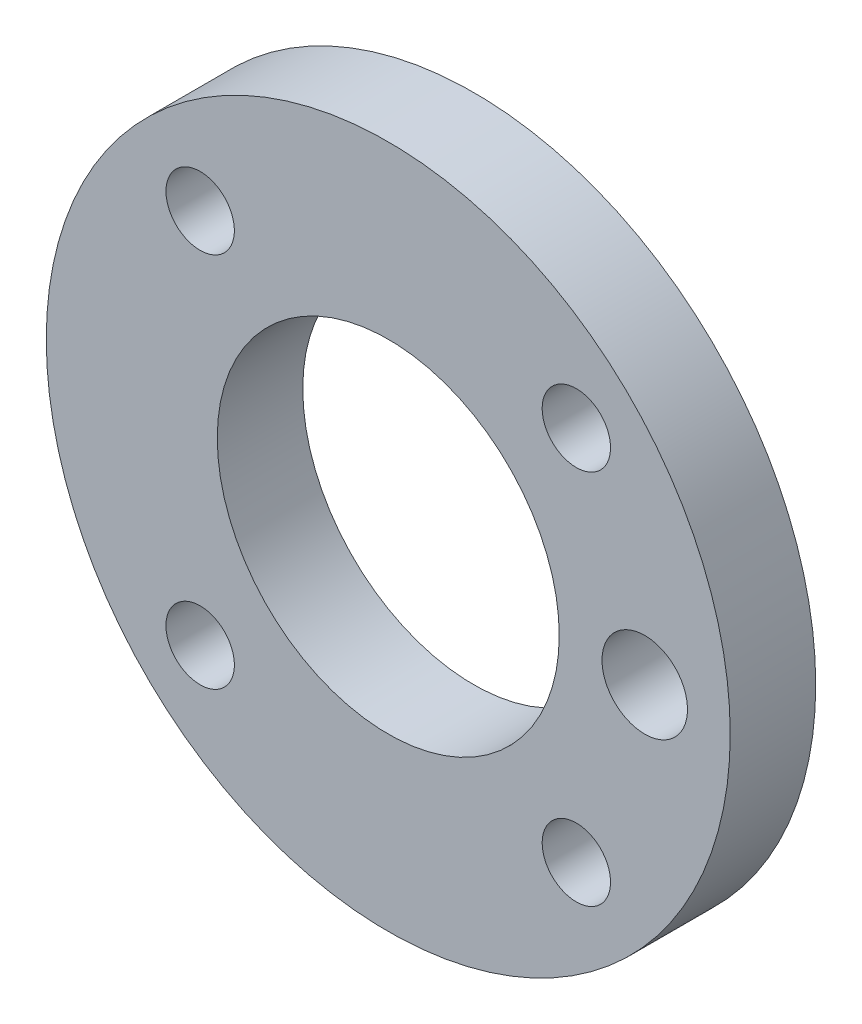
from build123d import *

# Parameters (mm, degrees)
SKETCH1_R             = 20
SKETCH1_R_2           = 10
SKETCH1_R_3           = 2
SKETCH1_R_4           = 2.5
BOSS_EXTRUDE1_DEPTH   = 5
BODY_MOVE_COPY1_ANGLE = 180


with BuildPart() as part:
    # Sketch1 → Boss-Extrude1 (new body)
    with BuildSketch(Plane(origin=(0, 0, 0), x_dir=(0, 0, -1), z_dir=(1, 0, 0))):
        Circle(SKETCH1_R)
        Circle(SKETCH1_R_2, mode=Mode.SUBTRACT)
        with Locations((-11, 11)):
            Circle(SKETCH1_R_3, mode=Mode.SUBTRACT)
        with Locations((11, 11)):
            Circle(SKETCH1_R_3, mode=Mode.SUBTRACT)
        with Locations((11, -11)):
            Circle(SKETCH1_R_3, mode=Mode.SUBTRACT)
        with Locations((-11, -11)):
            Circle(SKETCH1_R_3, mode=Mode.SUBTRACT)
        with Locations((-15, 0)):
            Circle(SKETCH1_R_4, mode=Mode.SUBTRACT)
    extrude(amount=BOSS_EXTRUDE1_DEPTH)


with BuildPart() as part_1:
    # Body-Move/Copy1: moved
    add(part.part.rotate(Axis((0, 0, 0), (0.7071067811865488, 0, 0.7071067811865462)), BODY_MOVE_COPY1_ANGLE))


solid = part_1.part
